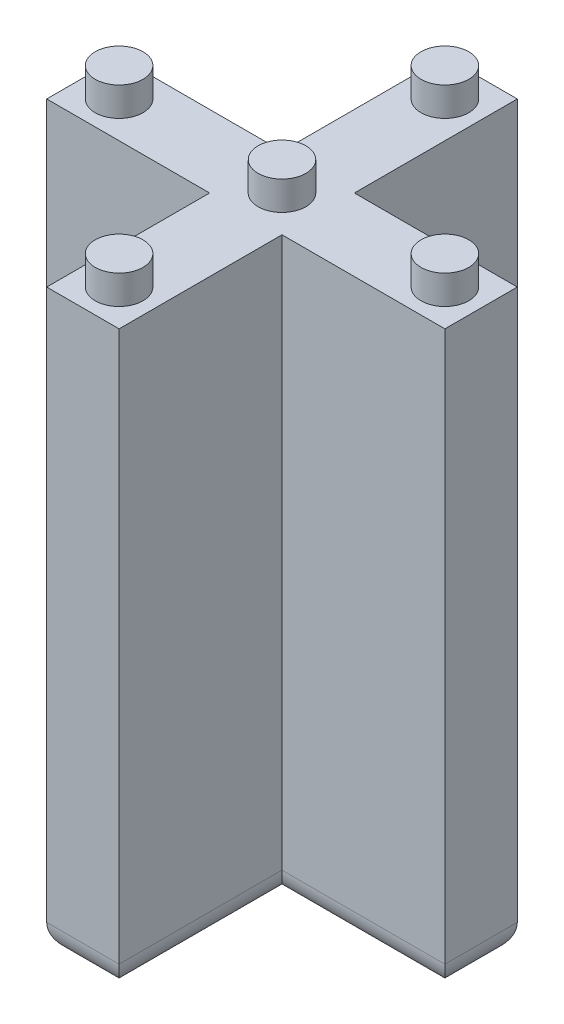
from build123d import *

# Parameters (mm, degrees)
BOSS_EXTRUDE1_DEPTH = 40
SKETCH2_R           = 1.65
BOSS_EXTRUDE2_DEPTH = 2
FILLET2_R           = 2


with BuildPart() as part:
    # Sketch1 → Boss-Extrude1 (new body)
    with BuildSketch(Plane(origin=(0, 0, 0), x_dir=(1, 0, 0), z_dir=(0, 1, 0))):
        Polygon((-2.5, -13.75), (2.5, -13.75), (2.5, -2.5), (13.75, -2.5), (13.75, 2.5), (2.5, 2.5), (2.5, 13.75), (-2.5, 13.75), (-2.5, 2.5), (-13.75, 2.5), (-13.75, -2.5), (-2.5, -2.5), align=None)
    extrude(amount=BOSS_EXTRUDE1_DEPTH)

    # Sketch2 → Boss-Extrude2 (add)
    with BuildSketch(Plane(origin=(0, 40, 0), x_dir=(1, 0, 0), z_dir=(0, 1, 0))):
        with Locations(Location((0, 0, 0), (0, 0, 270))):
            Circle(SKETCH2_R)
        with Locations(Location((11.25, 0, 0), (0, 0, 270))):
            Circle(SKETCH2_R)
        with Locations(Location((-11.25, 0, 0), (0, 0, 270))):
            Circle(SKETCH2_R)
        with Locations(Location((0, 11.25, 0), (0, 0, 270))):
            Circle(SKETCH2_R)
        with Locations(Location((0, -11.25, 0), (0, 0, 270))):
            Circle(SKETCH2_R)
    extrude(amount=BOSS_EXTRUDE2_DEPTH)

    # Fillet2
    fillet2_edges = [part.edges().sort_by_distance(p)[0] for p in [
        (13.75, 0, 0),
        (8.125, 0, 2.5),
        (2.5, 0, 8.125),
        (0, 0, 13.75),
        (-2.5, 0, 8.125),
        (-8.125, 0, 2.5),
        (-13.75, 0, 0),
        (-8.125, 0, -2.5),
        (-2.5, 0, -8.125),
        (0, 0, -13.75),
        (2.5, 0, -8.125),
        (8.125, 0, -2.5),
    ]]
    fillet(fillet2_edges, radius=FILLET2_R)


solid = part.part
